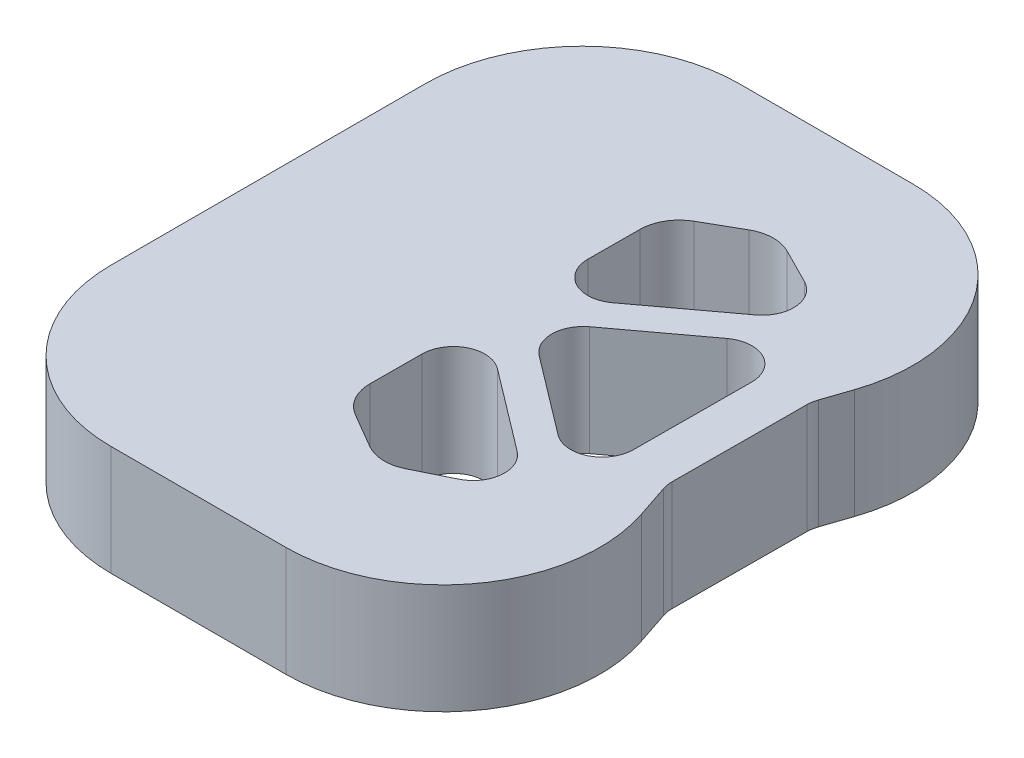
from build123d import *

# Parameters (mm, degrees)
SKETCH1_W           = 35
SKETCH1_H           = 40
BOSS_EXTRUDE1_DEPTH = 7
CUT_EXTRUDE1_DEPTH  = 8
FILLET1_R           = 10


with BuildPart() as part:
    # Sketch1 → Boss-Extrude1 (new body)
    with BuildSketch(Plane(origin=(0, 0, 0), x_dir=(1, 0, 0), z_dir=(0, 1, 0))):
        Rectangle(SKETCH1_W, SKETCH1_H)
    extrude(amount=BOSS_EXTRUDE1_DEPTH)

    # Sketch2 → Cut-Extrude1 (cut)
    with BuildSketch(Plane(origin=(0, 7, 0), x_dir=(1, 0, 0), z_dir=(0, 1, 0))):
        with BuildLine():
            Line((15.25007819, 6.222406887), (17.5, 5.083636977))
            Line((17.5, 5.083636977), (17.5, 20))
            Line((17.5, 20), (12.452367732, 5.078850678))
            ThreePointArc((12.452367732, 5.078850678), (13.590179491, 6.289271676), (15.25007819, 6.222406887))
        make_face()
        with BuildLine():
            Line((17.5, -4.742517197), (17.5, 5.083636977))
            Line((17.5, 5.083636977), (15.25007819, 6.222406887))
            ThreePointArc((15.25007819, 6.222406887), (13.590179491, 6.289271676), (12.452367732, 5.078850678))
            ThreePointArc((12.452367732, 5.078850678), (12.374244311, 4.767544782), (12.346923988, 4.447750739))
            Line((12.346923988, 4.447750739), (12.305154889, -4.080011014))
            ThreePointArc((12.305154889, -4.080011014), (12.330174144, -4.405315746), (12.407751507, -4.722224068))
            ThreePointArc((12.407751507, -4.722224068), (13.535222521, -5.935678289), (15.190785632, -5.883020714))
            Line((15.190785632, -5.883020714), (17.5, -4.742517197))
        make_face()
        with BuildLine():
            Line((17.5, -20), (17.5, -4.742517197))
            Line((17.5, -4.742517197), (15.190785632, -5.883020714))
            ThreePointArc((15.190785632, -5.883020714), (13.535222521, -5.935678289), (12.407751507, -4.722224068))
            Line((12.407751507, -4.722224068), (17.5, -20))
        make_face()
        with BuildLine():
            Line((1.11774743, -1.361450371), (6.099320122, -5.135895168))
            ThreePointArc((6.099320122, -5.135895168), (8.192797189, -5.335005696), (9.307118466, -3.551587818))
            Line((9.307118466, -3.551587818), (9.343853133, 3.94832222))
            ThreePointArc((9.343853133, 3.94832222), (8.247055315, 5.742570191), (6.151728246, 5.563976485))
            Line((6.151728246, 5.563976485), (1.133420888, 1.838511245))
            ThreePointArc((1.133420888, 1.838511245), (0.325593755, 0.242448801), (1.11774743, -1.361450371))
        make_face()
        with BuildLine():
            Line((-2.632460294, 8.813664358), (-2.648655993, 5.507079694))
            ThreePointArc((-2.648655993, 5.507079694), (-1.551858174, 3.712831723), (0.543468894, 3.891425428))
            Line((0.543468894, 3.891425428), (5.773694974, 7.774213801))
            ThreePointArc((5.773694974, 7.774213801), (6.574320559, 9.549924863), (5.484724289, 11.164524215))
            Line((5.484724289, 11.164524215), (3.228851981, 12.306305896))
            ThreePointArc((3.228851981, 12.306305896), (2.037191792, 12.574954754), (0.86049862, 12.246900805))
            Line((0.86049862, 12.246900805), (-1.371870903, 10.972579453))
            ThreePointArc((-1.371870903, 10.972579453), (-2.291405376, 10.06200886), (-2.632460294, 8.813664358))
        make_face()
        with BuildLine():
            Line((0.507713818, -3.408487008), (5.699653959, -7.3423233))
            ThreePointArc((5.699653959, -7.3423233), (6.482846631, -9.125791927), (5.377486357, -10.729640351))
            Line((5.377486357, -10.729640351), (3.110537628, -11.849269189))
            ThreePointArc((3.110537628, -11.849269189), (1.916302986, -12.1062319), (0.742879821, -11.766667047))
            Line((0.742879821, -11.766667047), (-1.476899604, -10.470539006))
            ThreePointArc((-1.476899604, -10.470539006), (-2.387470197, -9.551004532), (-2.716280225, -8.299379022))
            Line((-2.716280225, -8.299379022), (-2.700084526, -4.992794358))
            ThreePointArc((-2.700084526, -4.992794358), (-1.585763249, -3.20937648), (0.507713818, -3.408487008))
        make_face()
    extrude(amount=-CUT_EXTRUDE1_DEPTH, mode=Mode.SUBTRACT)

    # Fillet1
    fillet1_edges = [part.edges().sort_by_distance(p)[0] for p in [
        (17.5, 3.5, 20),
        (-17.5, 3.5, 20),
        (-17.5, 3.5, -20),
        (17.5, 3.5, -20),
    ]]
    fillet(fillet1_edges, radius=FILLET1_R)


solid = part.part
